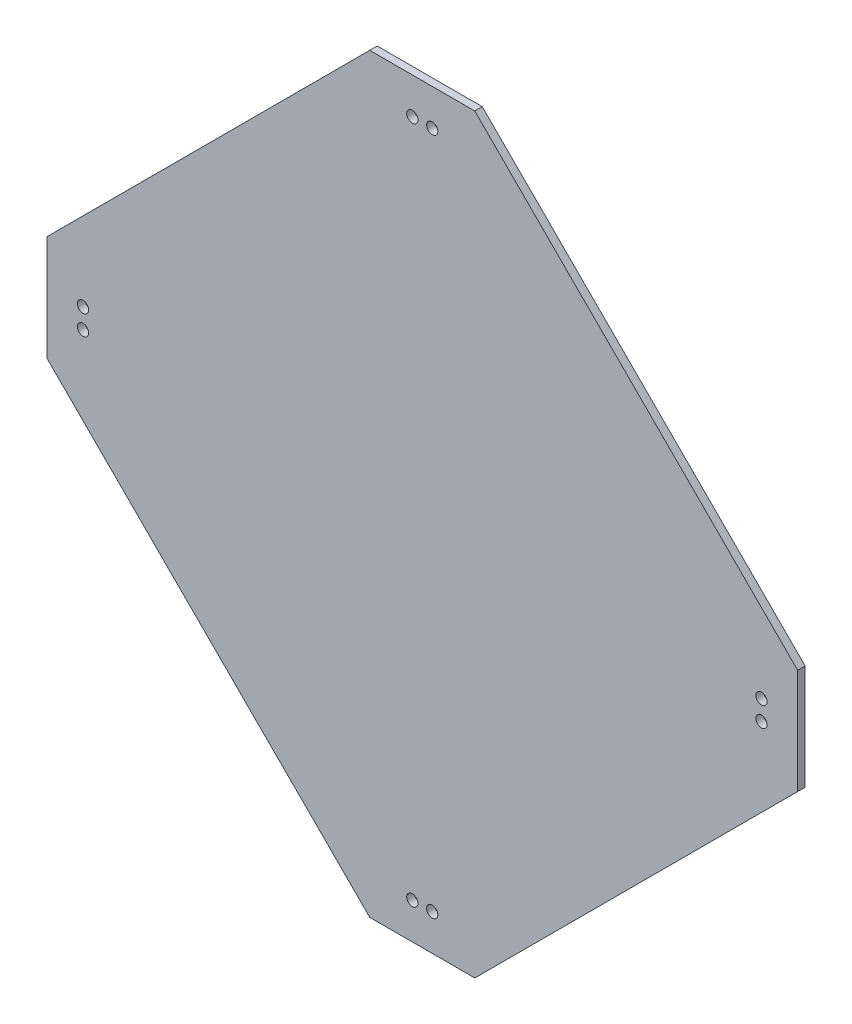
from build123d import *

# Parameters (mm, degrees)
SKETCH2_R           = 2.25
BOSS_EXTRUDE1_DEPTH = 3


with BuildPart() as part:
    # Sketch2 → Boss-Extrude1 (new body)
    with BuildSketch(Plane(origin=(54.951104055, -12.928200351, 0), x_dir=(1, 0, 0), z_dir=(0, 0, 1))):
        Polygon((150.346314429, -129.315759544), (150.346314429, -171.376869313), (85.688434657, -236.034749085), (-85.688434657, -64.657879772), (-21.030554884, 0), (21.030554884, 0), align=None)
        with Locations((-3.979949748, -14.5)):
            Circle(SKETCH2_R, mode=Mode.SUBTRACT)
        with Locations((3.979949748, -14.5)):
            Circle(SKETCH2_R, mode=Mode.SUBTRACT)
        with Locations((135.846314429, -154.326264177)):
            Circle(SKETCH2_R, mode=Mode.SUBTRACT)
        with Locations((135.846314429, -146.36636468)):
            Circle(SKETCH2_R, mode=Mode.SUBTRACT)
    extrude(amount=BOSS_EXTRUDE1_DEPTH)

    # Mirror1: part across plane


with BuildPart() as part_1:
    add(part.part)
    add(part.part.mirror(Plane(origin=(140.639538712, -248.962949436, 3), x_dir=(0, 0, 1), z_dir=(0.707106781186551, 0.7071067811865441, 0))))


solid = part_1.part
